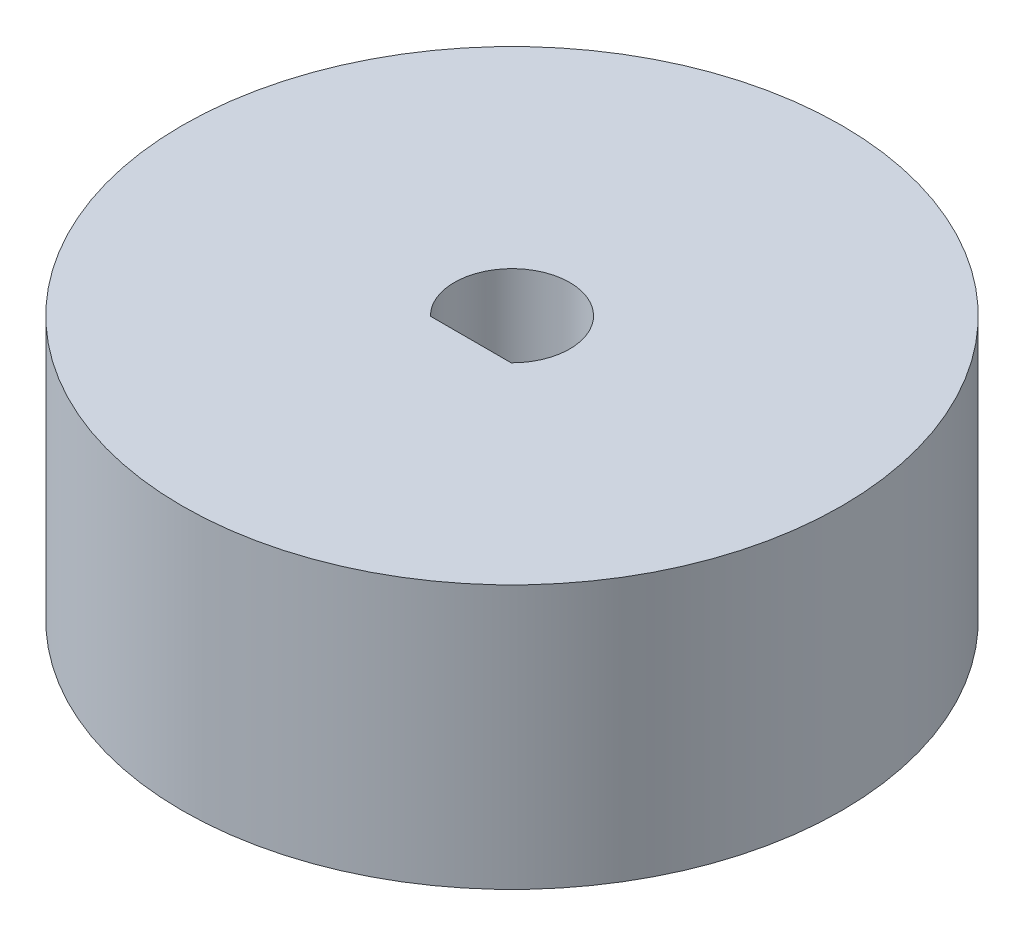
from build123d import *

# Parameters (mm, degrees)
SKETCH1_R           = 12.7
BOSS_EXTRUDE1_DEPTH = 10.16
CUT_EXTRUDE1_DEPTH  = 21.635057548


with BuildPart() as part:
    # Sketch1 → Boss-Extrude1 (new body)
    with BuildSketch(Plane(origin=(0, 0, 0), x_dir=(1, 0, 0), z_dir=(0, 1, 0))):
        with Locations(Location((0, 0, 0), (0, 0, 270))):
            Circle(SKETCH1_R)
    extrude(amount=BOSS_EXTRUDE1_DEPTH)

    # Sketch2 → Cut-Extrude1 (cut, through all)
    with BuildSketch(Plane(origin=(0, 10.16, 0), x_dir=(1, 0, 0), z_dir=(0, 1, 0))):
        with BuildLine():
            Line((-1.555425987, -1.5875), (1.555425987, -1.5875))
            ThreePointArc((1.555425987, -1.5875), (0, 2.2225), (-1.555425987, -1.5875))
        make_face()
    extrude(amount=-CUT_EXTRUDE1_DEPTH, mode=Mode.SUBTRACT)


solid = part.part
